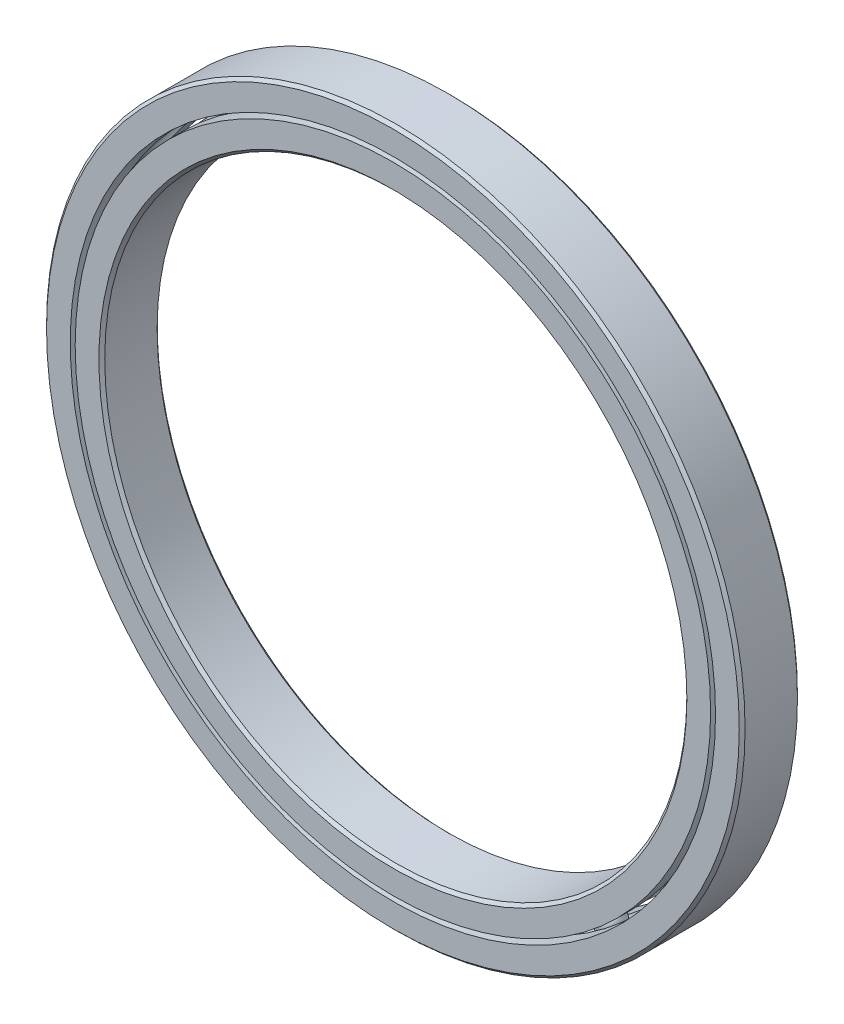
from build123d import *

# Parameters (mm, degrees)
CIRPATTERN1_COUNT = 10


with BuildPart() as part:
    # Sketch1 → Revolve1 (revolve)
    with BuildSketch(Plane(origin=(0, 0, 0), x_dir=(0, 0, -1), z_dir=(1, 0, 0))):
        with BuildLine():
            Line((2.8575, 38.1), (-2.8575, 38.1))
            Line((-2.8575, 38.1), (-3.175, 37.7825))
            Line((-3.175, 37.7825), (-3.175, 35.193653846))
            Line((-3.175, 35.193653846), (-1.411111111, 35.193653846))
            ThreePointArc((-1.411111111, 35.193653846), (0, 36.361457259), (1.411111111, 35.193653846))
            Line((1.411111111, 35.193653846), (3.175, 35.193653846))
            Line((3.175, 35.193653846), (3.175, 37.7825))
            Line((3.175, 37.7825), (2.8575, 38.1))
        make_face()
    revolve(axis=Axis((0, 0, 3.175), (0, 0, -1)))


with BuildPart() as body_2:
    # Sketch3 → Revolve3 (revolve)
    with BuildSketch(Plane(origin=(0, 0, 0), x_dir=(0, 0, -1), z_dir=(1, 0, 0))):
        with BuildLine():
            Line((-3.175, 34.656346154), (-1.411111111, 34.656346154))
            ThreePointArc((-1.411111111, 34.656346154), (0, 33.488542741), (1.411111111, 34.656346154))
            Line((1.411111111, 34.656346154), (3.175, 34.656346154))
            Line((3.175, 34.656346154), (3.175, 32.0675))
            Line((3.175, 32.0675), (2.8575, 31.75))
            Line((2.8575, 31.75), (-2.8575, 31.75))
            Line((-2.8575, 31.75), (-3.175, 32.0675))
            Line((-3.175, 32.0675), (-3.175, 34.656346154))
        make_face()
    revolve(axis=Axis((0, 0, 3.175), (0, 0, -1)))


with BuildPart() as body_3:
    # Sketch4 → Revolve4 (revolve)
    with BuildSketch(Plane(origin=(0, 0, 0), x_dir=(0, 0, -1), z_dir=(1, 0, 0))):
        with BuildLine():
            Line((-1.436457259, 34.925), (1.436457259, 34.925))
            ThreePointArc((1.436457259, 34.925), (0, 36.361457259), (-1.436457259, 34.925))
        make_face()
    revolve(axis=Axis((0, 34.925, 1.436457259), (0, 0, -1)))


with BuildPart() as cirpattern1_1:
    # CirPattern1: pattern copy
    add(body_3.part.rotate(Axis((0, 0, -3.175), (0, 0, 1)), 1 * 360 / CIRPATTERN1_COUNT))


with BuildPart() as cirpattern1_2:
    # CirPattern1: pattern copy
    add(body_3.part.rotate(Axis((0, 0, -3.175), (0, 0, 1)), 2 * 360 / CIRPATTERN1_COUNT))


with BuildPart() as cirpattern1_3:
    # CirPattern1: pattern copy
    add(body_3.part.rotate(Axis((0, 0, -3.175), (0, 0, 1)), 3 * 360 / CIRPATTERN1_COUNT))


with BuildPart() as cirpattern1_4:
    # CirPattern1: pattern copy
    add(body_3.part.rotate(Axis((0, 0, -3.175), (0, 0, 1)), 4 * 360 / CIRPATTERN1_COUNT))


with BuildPart() as cirpattern1_5:
    # CirPattern1: pattern copy
    add(body_3.part.rotate(Axis((0, 0, -3.175), (0, 0, 1)), 5 * 360 / CIRPATTERN1_COUNT))


with BuildPart() as cirpattern1_6:
    # CirPattern1: pattern copy
    add(body_3.part.rotate(Axis((0, 0, -3.175), (0, 0, 1)), 6 * 360 / CIRPATTERN1_COUNT))


with BuildPart() as cirpattern1_7:
    # CirPattern1: pattern copy
    add(body_3.part.rotate(Axis((0, 0, -3.175), (0, 0, 1)), 7 * 360 / CIRPATTERN1_COUNT))


with BuildPart() as cirpattern1_8:
    # CirPattern1: pattern copy
    add(body_3.part.rotate(Axis((0, 0, -3.175), (0, 0, 1)), 8 * 360 / CIRPATTERN1_COUNT))


with BuildPart() as cirpattern1_9:
    # CirPattern1: pattern copy
    add(body_3.part.rotate(Axis((0, 0, -3.175), (0, 0, 1)), 9 * 360 / CIRPATTERN1_COUNT))


solid = Compound([part.part, body_2.part, body_3.part, cirpattern1_1.part, cirpattern1_2.part, cirpattern1_3.part, cirpattern1_4.part, cirpattern1_5.part, cirpattern1_6.part, cirpattern1_7.part, cirpattern1_8.part, cirpattern1_9.part])
